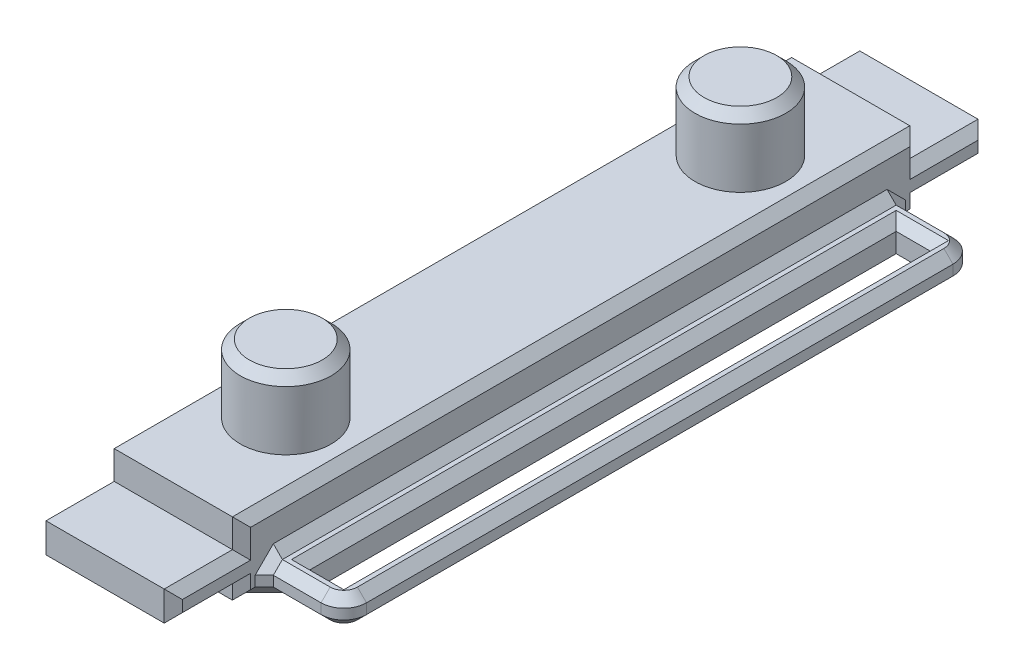
from build123d import *

# Parameters (mm, degrees)
BOSS_EXTRUDE1_DEPTH = 12
SKETCH2_R           = 4
BOSS_EXTRUDE2_DEPTH = 6
SKETCH3_W           = 55.6
SKETCH3_H           = 2.5
BOSS_EXTRUDE3_DEPTH = 7
SKETCH5_W           = 3
SKETCH5_H           = 51.6
CUT_EXTRUDE1_DEPTH  = 42.791956142
FILLET3_R           = 2
CHAMFER1_SIZE       = 0.8
CHAMFER2_SIZE       = 0.8
CHAMFER3_SIZE       = 0.8


with BuildPart() as part:
    # Sketch1 → Boss-Extrude1 (new body)
    with BuildSketch(Plane(origin=(0, 0, 0), x_dir=(0, 0, -1), z_dir=(1, 0, 0))):
        Polygon((-29.89631037, 3.89631037), (-29.89631037, 1.39631037), (-35.89631037, 1.39631037), (-35.89631037, -1.20368963), (-29.89631037, -1.20368963), (-29.89631037, -2.45368963), (29.70368963, -2.45368963), (29.70368963, -1.20368963), (35.70368963, -1.20368963), (35.70368963, 1.39631037), (29.70368963, 1.39631037), (29.70368963, 3.89631037), align=None)
    extrude(amount=BOSS_EXTRUDE1_DEPTH)

    # Sketch2 → Boss-Extrude2 (add)
    with BuildSketch(Plane(origin=(0, 3.89631037, 0), x_dir=(1, 0, 0), z_dir=(0, 1, 0))):
        with Locations(Location((6, -20, 0), (0, 0, 90))):
            Circle(SKETCH2_R)
        with Locations(Location((6, 20, 0), (0, 0, 90))):
            Circle(SKETCH2_R)
    extrude(amount=BOSS_EXTRUDE2_DEPTH)

    # Sketch3 → Boss-Extrude3 (add)
    with BuildSketch(Plane(origin=(12, 0, 0), x_dir=(0, 0, -1), z_dir=(1, 0, 0))):
        with Locations((-0.09631037, -1.20368963)):
            Rectangle(SKETCH3_W, SKETCH3_H)
    extrude(amount=BOSS_EXTRUDE3_DEPTH)

    # Sketch5 → Cut-Extrude1 (cut, through all)
    with BuildSketch(Plane(origin=(0, 0.04631037, 0), x_dir=(1, 0, 0), z_dir=(0, 1, 0))):
        with Locations((15.5, -0.09631037)):
            Rectangle(SKETCH5_W, SKETCH5_H)
    extrude(amount=-CUT_EXTRUDE1_DEPTH, mode=Mode.SUBTRACT)

    # Fillet3
    fillet3_edges = [part.edges().sort_by_distance(p)[0] for p in [
        (19, -1.20368963, 27.89631037),
        (19, -1.20368963, -27.70368963),
    ]]
    fillet(fillet3_edges, radius=FILLET3_R)

    # Chamfer1
    chamfer1_edges = [part.edges().sort_by_distance(p)[0] for p in [
        (0, 2.64631037, -29.70368963),
        (0, 1.39631037, -32.70368963),
        (0, 0.09631037, -35.70368963),
        (0, -1.20368963, -32.70368963),
        (0, -1.82868963, -29.70368963),
        (0, -2.45368963, 0.09631037),
        (0, -1.82868963, 29.89631037),
        (0, -1.20368963, 32.89631037),
        (0, 0.09631037, 35.89631037),
        (0, 1.39631037, 32.89631037),
        (0, 2.64631037, 29.89631037),
        (0, 3.89631037, 0.09631037),
    ]]
    chamfer(chamfer1_edges, length=CHAMFER1_SIZE)

    # Chamfer2
    chamfer2_edges = [part.edges().sort_by_distance(p)[0] for p in [
        (6, 9.89631037, 24),
        (6, 9.89631037, -16),
    ]]
    chamfer(chamfer2_edges, length=CHAMFER2_SIZE)

    # Chamfer3
    chamfer3_edges = [part.edges().sort_by_distance(p)[0] for p in [
        (12, 1.39631037, 32.89631037),
        (12, 0.09631037, 35.89631037),
        (12, -1.20368963, 32.89631037),
        (12, -1.82868963, 29.89631037),
        (12, -2.45368963, 28.89631037),
        (12, -1.82868963, -29.70368963),
        (12, -1.20368963, -32.70368963),
        (12, 0.09631037, -35.70368963),
        (12, 1.39631037, -32.70368963),
        (12, -2.45368963, -28.70368963),
        (12, -1.20368963, 27.89631037),
        (12, -1.20368963, -27.70368963),
        (12, 2.64631037, -29.70368963),
        (12, 0.04631037, 0.09631037),
        (12, 3.89631037, 0.09631037),
        (15.5, 0.04631037, -25.70368963),
        (14, 0.04631037, 0.09631037),
        (15.5, 0.04631037, 25.89631037),
        (17, 0.04631037, 0.09631037),
        (19, -2.45368963, 0.09631037),
        (19, 0.04631037, 0.09631037),
        (14.5, 0.04631037, 27.89631037),
        (14.5, 0.04631037, -27.70368963),
        (18.414213562, 0.04631037, 27.310523932),
        (18.414213562, 0.04631037, -27.117903192),
        (14.5, -2.45368963, -27.70368963),
        (14.5, -2.45368963, 27.89631037),
        (18.414213562, -2.45368963, 27.310523932),
        (18.414213562, -2.45368963, -27.117903192),
        (12, 2.64631037, 29.89631037),
    ]]
    chamfer(chamfer3_edges, length=CHAMFER3_SIZE)


solid = part.part
